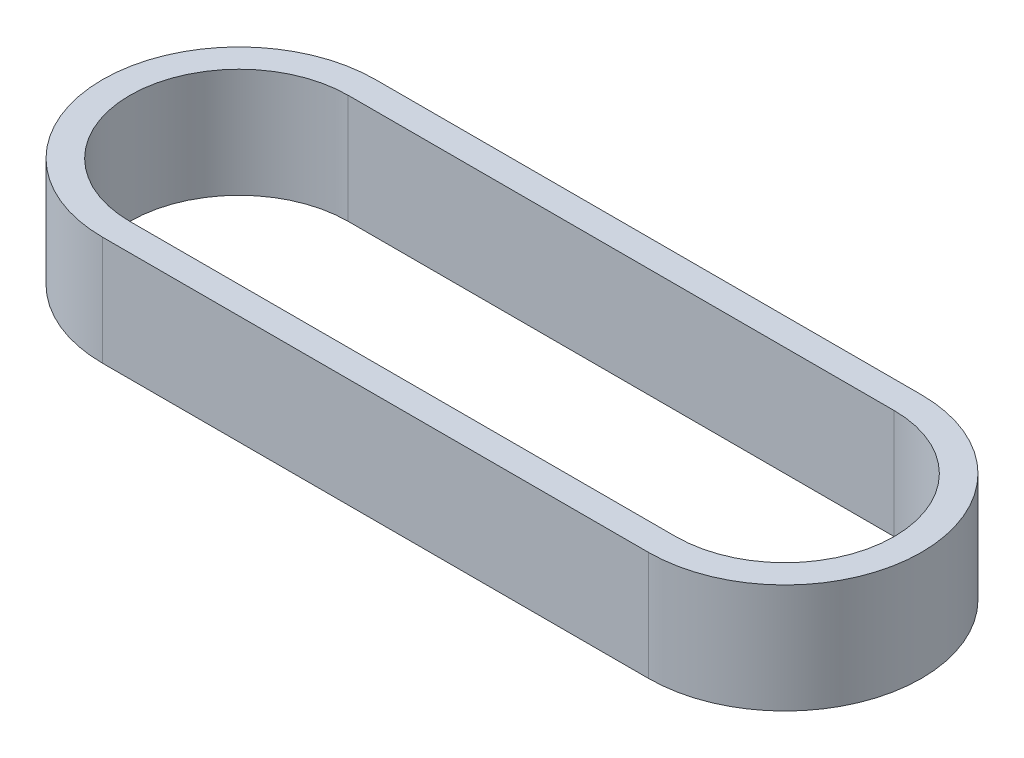
from build123d import *

# Parameters (mm, degrees)
BOSS_EXTRUDE4_DEPTH = 20


with BuildPart() as part:
    # Sketch1 → Boss-Extrude4 (new body)
    with BuildSketch(Plane(origin=(0, 0, 0), x_dir=(1, 0, 0), z_dir=(0, 1, 0))):
        with BuildLine():
            Line((-50, -25), (50, -25))
            ThreePointArc((50, -25), (75, -3.4e-08), (50.000000068, 25))
            Line((50.000000068, 25), (-50, 25))
            ThreePointArc((-50, 25), (-75, 0), (-50, -25))
        make_face()
        with BuildLine():
            ThreePointArc((-50, -20), (-70, 0), (-50, 20))
            Line((-50, 20), (50, 20))
            ThreePointArc((50, 20), (70, 0), (50, -20))
            Line((50, -20), (-50, -20))
        make_face(mode=Mode.SUBTRACT)
    extrude(amount=BOSS_EXTRUDE4_DEPTH)


solid = part.part
